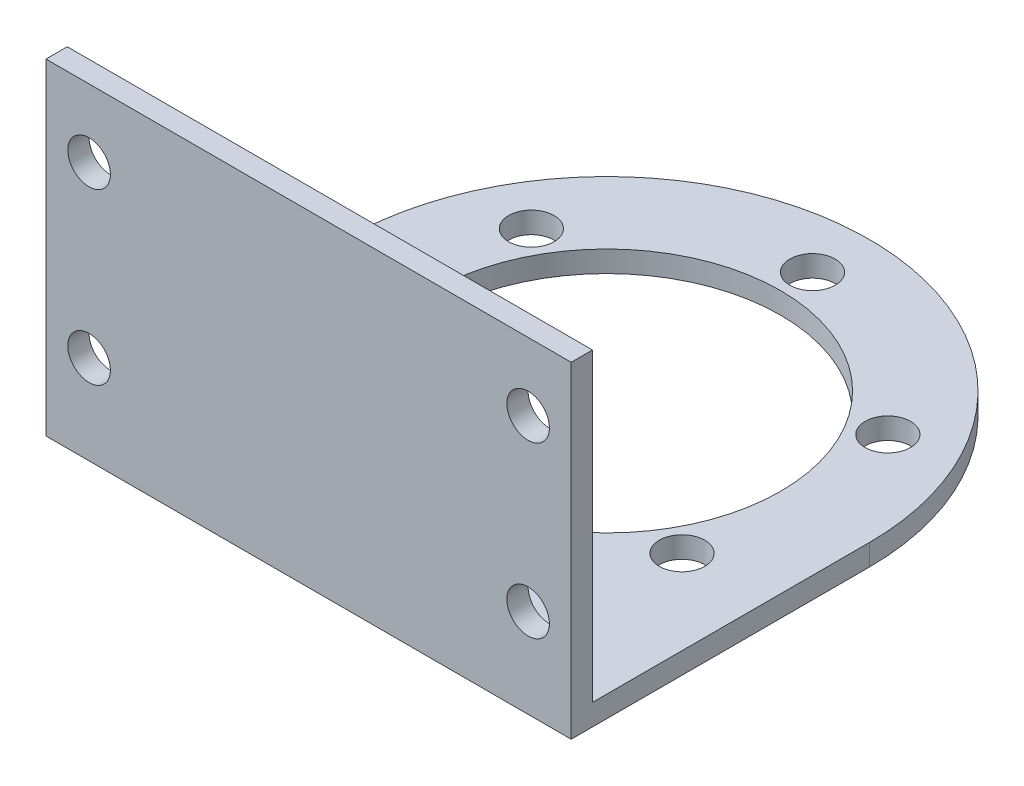
from build123d import *

# Parameters (mm, degrees)
SKETCH1_R           = 12.25
BOSS_EXTRUDE1_DEPTH = 1.5
SKETCH4_W           = 37
SKETCH4_H           = 1.5
BOSS_EXTRUDE2_DEPTH = 21.5
SKETCH6_R           = 1.5
CUT_EXTRUDE2_DEPTH  = 10
SKETCH3_R           = 1.6
CUT_EXTRUDE3_DEPTH  = 10
CIRPATTERN1_COUNT   = 6


with BuildPart() as part:
    # Sketch1 → Boss-Extrude1 (new body)
    with BuildSketch(Plane(origin=(0, 0, 0), x_dir=(1, 0, 0), z_dir=(0, 1, 0))):
        with BuildLine():
            Line((-23.391313752, 9.062201448), (-23.391313752, -11.937798552))
            Line((-23.391313752, -11.937798552), (13.608686248, -11.937798552))
            Line((13.608686248, -11.937798552), (13.608686248, 9.062201448))
            ThreePointArc((13.608686248, 9.062201448), (-4.891313752, 27.562201448), (-23.391313752, 9.062201448))
        make_face()
        with Locations(Location((-4.891313752, 9.062201448, 0), (0, 0, 270))):
            Circle(SKETCH1_R, mode=Mode.SUBTRACT)
    extrude(amount=BOSS_EXTRUDE1_DEPTH)

    # Sketch4 → Boss-Extrude2 (add)
    with BuildSketch(Plane(origin=(0, 1.5, 0), x_dir=(1, 0, 0), z_dir=(0, 1, 0))):
        with Locations((-4.891313752, -11.187798552)):
            Rectangle(SKETCH4_W, SKETCH4_H)
    extrude(amount=BOSS_EXTRUDE2_DEPTH)

    # Sketch6 → Cut-Extrude2 (cut)
    with BuildSketch(Plane(origin=(0, 0, 10.437798552), x_dir=(-1, 0, 0), z_dir=(0, 0, -1))):
        with Locations((-10.573464155, 6.27963227)):
            Circle(SKETCH6_R)
        with Locations((20.356091659, 6.27963227)):
            Circle(SKETCH6_R)
        with Locations((20.356091659, 18.22036773)):
            Circle(SKETCH6_R)
        with Locations((-10.573464155, 18.22036773)):
            Circle(SKETCH6_R)
    extrude(amount=-CUT_EXTRUDE2_DEPTH, mode=Mode.SUBTRACT)

    # Sketch3 → Cut-Extrude3 (cut)
    with BuildSketch(Plane(origin=(0, 1.5, 0), x_dir=(1, 0, 0), z_dir=(0, 1, 0))):
        with Locations(Location((-4.891313752, 23.562201448, 0), (0, 0, 270))):
            Circle(SKETCH3_R)
    cut_extrude3 = extrude(amount=-CUT_EXTRUDE3_DEPTH, mode=Mode.SUBTRACT)

    # CirPattern1: Cut-Extrude3 ×6 about axis
    cirpattern1_axis = Axis((-4.891313752, 0, -9.062201448), (0, 1, 0))
    for i in range(1, CIRPATTERN1_COUNT):
        add(cut_extrude3.rotate(cirpattern1_axis, i * 360 / CIRPATTERN1_COUNT), mode=Mode.SUBTRACT)


solid = part.part
